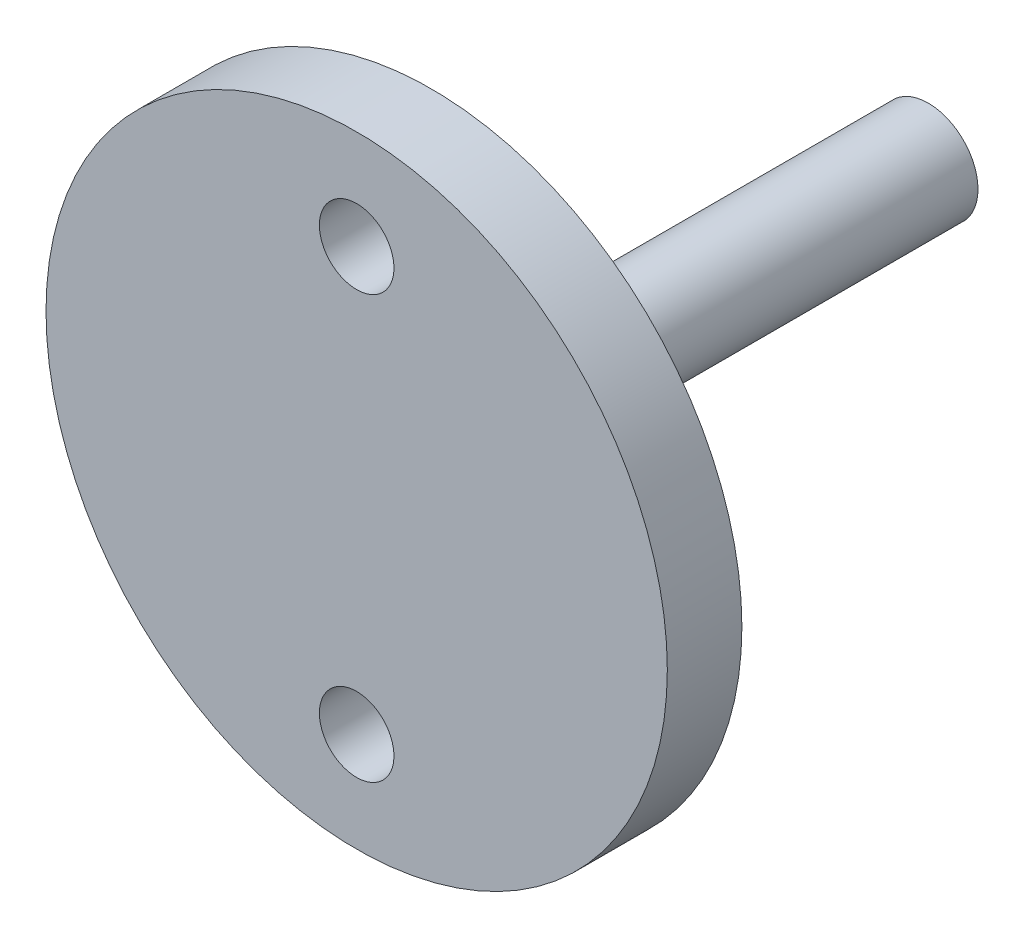
from build123d import *

# Parameters (mm, degrees)
SKETCH_1_R          = 12.5
EXTRUDE_1_DEPTH     = 3
SKETCH_2_R          = 1.5
CUT_EXTRUDE_1_DEPTH = 3
SKETCH_3_R          = 2
EXTRUDE_2_DEPTH     = 20


with BuildPart() as part:
    # 草图1 → 凸台-拉伸1 (new body)
    with BuildSketch(Plane.XY):
        Circle(SKETCH_1_R)
    extrude(amount=EXTRUDE_1_DEPTH)

    # 草图2 → 切除-拉伸1 (cut)
    with BuildSketch(Plane(origin=(0, 0, 0), x_dir=(-1, 0, 0), z_dir=(0, 0, -1))):
        with Locations((0, 8.5)):
            Circle(SKETCH_2_R)
        with Locations((0, -8.5)):
            Circle(SKETCH_2_R)
    extrude(amount=-CUT_EXTRUDE_1_DEPTH, mode=Mode.SUBTRACT)

    # 草图3 → 凸台-拉伸2 (add)
    with BuildSketch(Plane(origin=(0, 0, 0), x_dir=(-1, 0, 0), z_dir=(0, 0, -1))):
        with Locations(Location((0, 0, 0), (0, 0, 180))):
            Circle(SKETCH_3_R)
    extrude(amount=EXTRUDE_2_DEPTH)


solid = part.part
